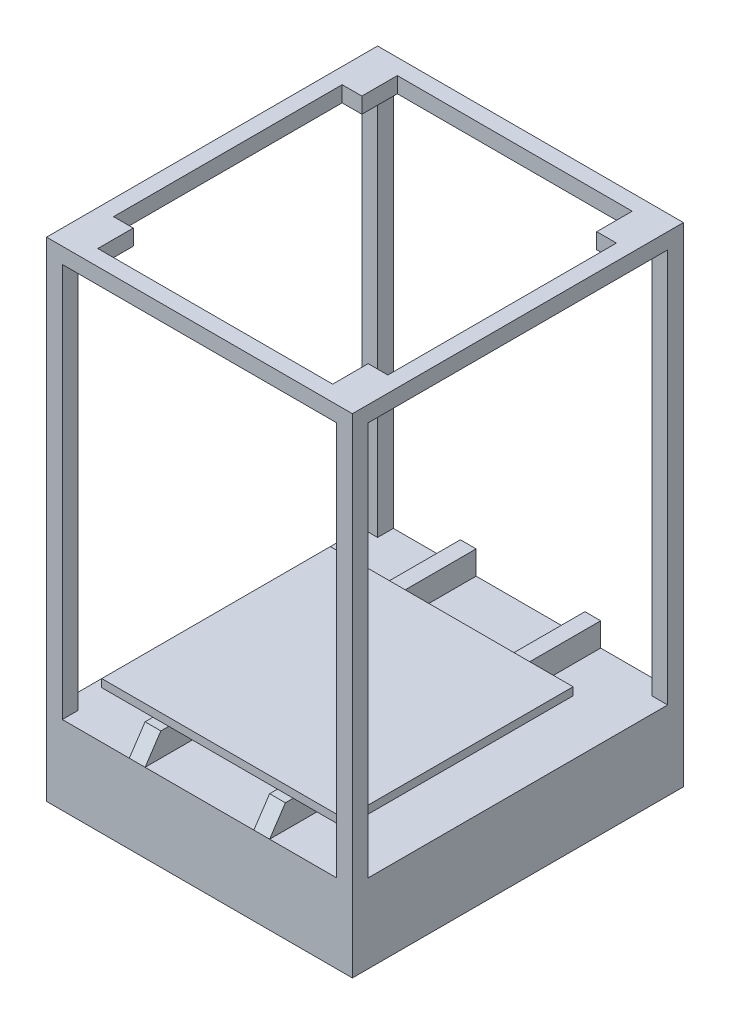
from build123d import *

# Parameters (mm, degrees)
SKETCH_1_W          = 388
SKETCH_1_H          = 100
EXTRUDE_1_DEPTH     = 420
SKETCH_2_W          = 20
SKETCH_2_H          = 420
EXTRUDE_2_DEPTH     = 30
SKETCH_3_W          = 20
SKETCH_3_H          = 20
EXTRUDE_3_DEPTH     = 500
SKETCH_4_W          = 388
SKETCH_4_H          = 420
EXTRUDE_4_DEPTH     = 20
SKETCH_6_W          = 308
SKETCH_6_H          = 290
EXTRUDE_6_DEPTH     = 10
CUT_EXTRUDE_1_REACH = 802.555
CUT_EXTRUDE_2_REACH = 845.412
SKETCH_8_W          = 348
SKETCH_8_H          = 380
SKETCH_9_W          = 45
SKETCH_9_H          = 20
EXTRUDE_7_DEPTH     = 25
SKETCH_10_W         = 45
SKETCH_10_H         = 20
EXTRUDE_8_DEPTH     = 25


with BuildPart() as part:
    # 草图1 → 凸台-拉伸1 (new body)
    with BuildSketch(Plane.XY):
        with Locations((194, 50)):
            Rectangle(SKETCH_1_W, SKETCH_1_H)
    extrude(amount=-EXTRUDE_1_DEPTH)

    # 草图2 → 凸台-拉伸2 (add)
    with BuildSketch(Plane(origin=(0, 100, 0), x_dir=(1, 0, 0), z_dir=(0, 1, 0))):
        with Locations((115, 210)):
            Rectangle(SKETCH_2_W, SKETCH_2_H)
        with Locations((273, 210)):
            Rectangle(SKETCH_2_W, SKETCH_2_H)
    extrude(amount=EXTRUDE_2_DEPTH)

    # 草图3 → 凸台-拉伸3 (add)
    with BuildSketch(Plane(origin=(0, 100, 0), x_dir=(1, 0, 0), z_dir=(0, 1, 0))):
        with Locations((10, 10)):
            Rectangle(SKETCH_3_W, SKETCH_3_H)
        with Locations((10, 410)):
            Rectangle(SKETCH_3_W, SKETCH_3_H)
        with Locations((378, 10)):
            Rectangle(SKETCH_3_W, SKETCH_3_H)
        with Locations((378, 410)):
            Rectangle(SKETCH_3_W, SKETCH_3_H)
    extrude(amount=EXTRUDE_3_DEPTH)

    # 草图4 → 凸台-拉伸4 (add)
    with BuildSketch(Plane(origin=(0, 600, 0), x_dir=(1, 0, 0), z_dir=(0, 1, 0))):
        with Locations((194, 210)):
            Rectangle(SKETCH_4_W, SKETCH_4_H)
    extrude(amount=EXTRUDE_4_DEPTH)

    # 草图6 → 凸台-拉伸6 (add)
    with BuildSketch(Plane(origin=(0, 130, 0), x_dir=(1, 0, 0), z_dir=(0, 1, 0))):
        with Locations((194, 175)):
            Rectangle(SKETCH_6_W, SKETCH_6_H)
    extrude(amount=EXTRUDE_6_DEPTH)

    # 切除-拉伸1: up to this face of the body (flat: up to its plane)
    cut_extrude_1_end = Plane(part.part.faces().sort_by_distance((283, 115, -210))[0])
    # 草图7 → 切除-拉伸1 (cut, up to the picked face)
    with BuildSketch(Plane.ZY.offset(-105), mode=Mode.PRIVATE) as cut_extrude_1_sk1:
        Polygon((0, 100), (-20, 130), (0, 130), align=None)
    cut_extrude_1_tool1 = split(extrude(cut_extrude_1_sk1.sketch, amount=-CUT_EXTRUDE_1_REACH, mode=Mode.PRIVATE), bisect_by=cut_extrude_1_end, keep=Keep.BOTH, mode=Mode.PRIVATE)
    add(cut_extrude_1_tool1.solids().sort_by(Axis((105, 120, -6.666667), (1, 0, 0)))[0], mode=Mode.SUBTRACT)

    # 草图8 → 切除-拉伸2 (cut, up to next)
    with BuildSketch(Plane(origin=(0, 620, 0), x_dir=(1, 0, 0), z_dir=(0, 1, 0)), mode=Mode.PRIVATE) as cut_extrude_2_sk1:
        with Locations((194, 210)):
            Rectangle(SKETCH_8_W, SKETCH_8_H)
    cut_extrude_2_tool1 = extrude(cut_extrude_2_sk1.sketch, amount=-CUT_EXTRUDE_2_REACH, mode=Mode.PRIVATE) & part.part
    add(cut_extrude_2_tool1.solids().sort_by_distance((194, 620, -210))[0], mode=Mode.SUBTRACT)

    # 草图9 → 凸台-拉伸7 (add)
    with BuildSketch(Plane.ZY.offset(-368)):
        with Locations((-42.5, 610)):
            Rectangle(SKETCH_9_W, SKETCH_9_H)
        with Locations((-377.5, 610)):
            Rectangle(SKETCH_9_W, SKETCH_9_H)
    extrude(amount=EXTRUDE_7_DEPTH)

    # 草图10 → 凸台-拉伸8 (add)
    with BuildSketch(Plane(origin=(20, 0, 0), x_dir=(0, 0, -1), z_dir=(1, 0, 0))):
        with Locations((377.5, 610)):
            Rectangle(SKETCH_10_W, SKETCH_10_H)
        with Locations((42.5, 610)):
            Rectangle(SKETCH_10_W, SKETCH_10_H)
    extrude(amount=EXTRUDE_8_DEPTH)


solid = part.part
